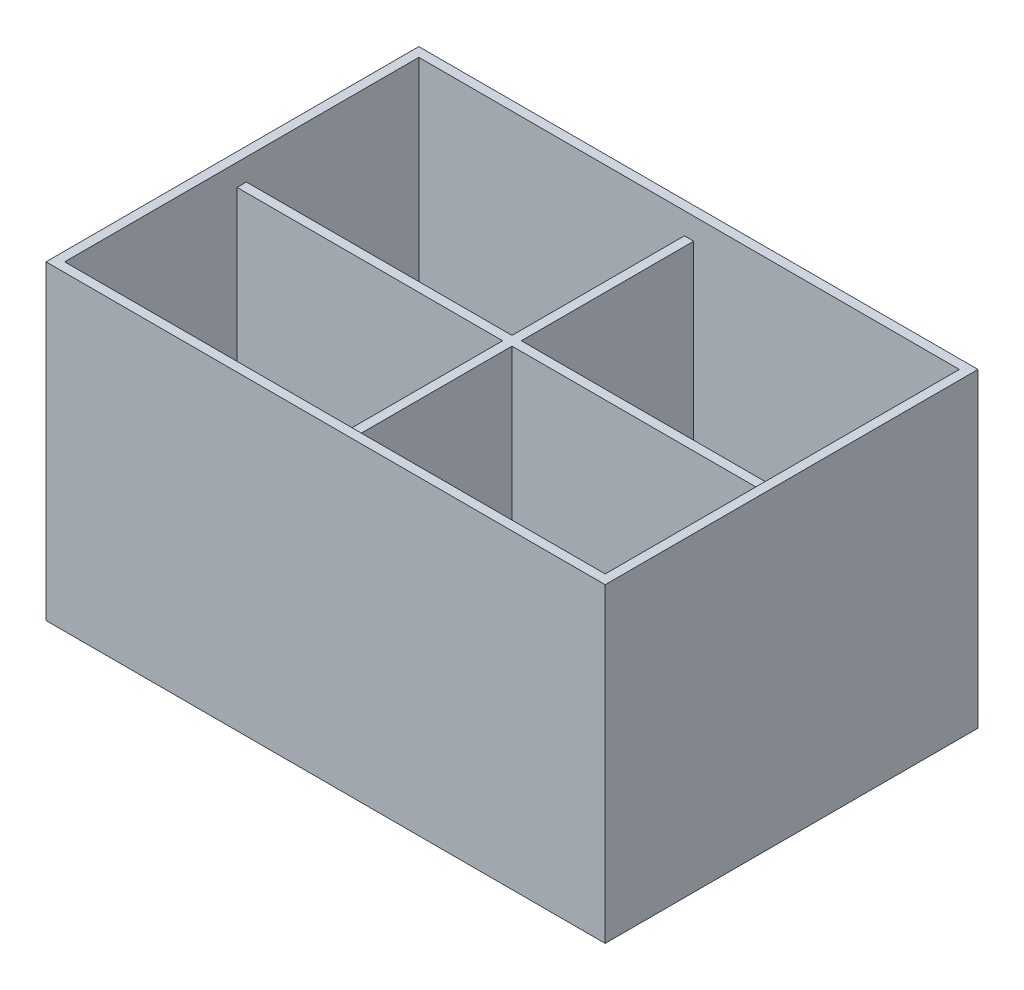
from build123d import *

# Parameters (mm, degrees)
SKETCH_1_W      = 87
SKETCH_1_H      = 57
EXTRUDE_1_DEPTH = 1.5
SKETCH_1_3_W    = 90
SKETCH_1_3_H    = 60
SKETCH_1_3_W_2  = 87
SKETCH_1_3_H_2  = 57
EXTRUDE_2_DEPTH = 50
EXTRUDE_3_DEPTH = 45


with BuildPart() as part:
    # 草图1 → 凸台-拉伸1 (new body)
    with BuildSketch(Plane(origin=(0, 0, 0), x_dir=(1, 0, 0), z_dir=(0, 1, 0))):
        Rectangle(SKETCH_1_W, SKETCH_1_H)
    extrude(amount=EXTRUDE_1_DEPTH)

    # 草图1<3> → 凸台-拉伸2 (add)
    with BuildSketch(Plane(origin=(0, 0, 0), x_dir=(1, 0, 0), z_dir=(0, 1, 0))):
        Rectangle(SKETCH_1_3_W, SKETCH_1_3_H)
        Rectangle(SKETCH_1_3_W_2, SKETCH_1_3_H_2, mode=Mode.SUBTRACT)
    extrude(amount=EXTRUDE_2_DEPTH)

    # 草图2 → 凸台-拉伸3 (add)
    with BuildSketch(Plane(origin=(0, 1.5, 0), x_dir=(1, 0, 0), z_dir=(0, 1, 0))):
        Polygon((0.75, -0.75), (43.5, -0.75), (43.5, 0.75), (0.75, 0.75), (0.75, 28.5), (-0.75, 28.5), (-0.75, 0.75), (-43.5, 0.75), (-43.5, -0.75), (-0.75, -0.75), (-0.75, -28.5), (0.75, -28.5), align=None)
    extrude(amount=EXTRUDE_3_DEPTH)


solid = part.part
